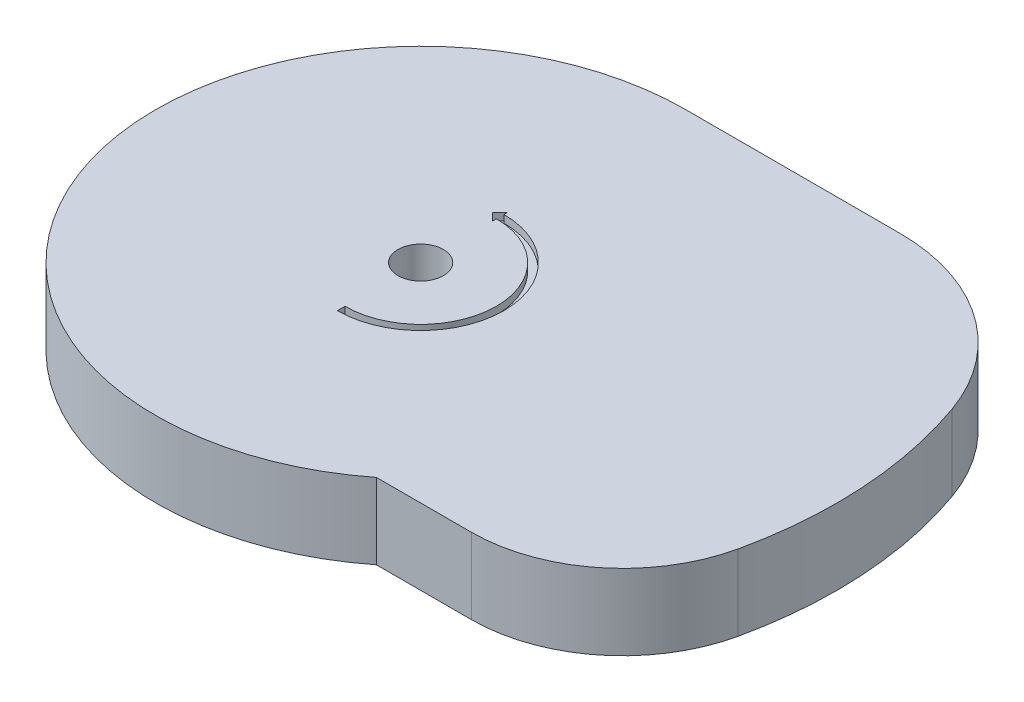
from build123d import *

# Parameters (mm, degrees)
SKETCH_1_R          = 3
EXTRUDE_1_DEPTH     = 10
CUT_EXTRUDE_1_DEPTH = 1


with BuildPart() as part:
    # 草圖1 → 填料-伸長1 (new body)
    with BuildSketch(Plane(origin=(0, 0, 0), x_dir=(1, 0, 0), z_dir=(0, 1, 0))):
        with BuildLine():
            Line((0, 35), (28.284271247, 35))
            ThreePointArc((28.284271247, 35), (42.718027977, 30.412414523), (51.854497287, 18.333333333))
            ThreePointArc((51.854497287, 18.333333333), (54.894534338, 3.404423566), (53.722406301, -11.785714286))
            ThreePointArc((53.722406301, -11.785714286), (46.722649239, -23.083874449), (34.186985828, -27.5))
            Line((34.186985828, -27.5), (21.650635095, -27.5))
            ThreePointArc((21.650635095, -27.5), (-33.071891388, -11.456439237), (0, 35))
        make_face()
        with Locations(Location((0, 0, 0), (0, 0, 270))):
            Circle(SKETCH_1_R, mode=Mode.SUBTRACT)
    extrude(amount=EXTRUDE_1_DEPTH)

    # 草圖2 → 除料-伸長1 (cut)
    with BuildSketch(Plane(origin=(0, 10, 0), x_dir=(1, 0, 0), z_dir=(0, 1, 0))):
        with BuildLine():
            Line((0, -10), (0, -11))
            ThreePointArc((0, -11), (11, 0), (0, 11))
            Line((0, 11), (0, 11.5))
            Line((0, 11.5), (-1, 10.5))
            Line((-1, 10.5), (0, 9.5))
            Line((0, 9.5), (0, 10))
            ThreePointArc((0, 10), (10, 0), (0, -10))
        make_face()
    extrude(amount=-CUT_EXTRUDE_1_DEPTH, mode=Mode.SUBTRACT)


solid = part.part
